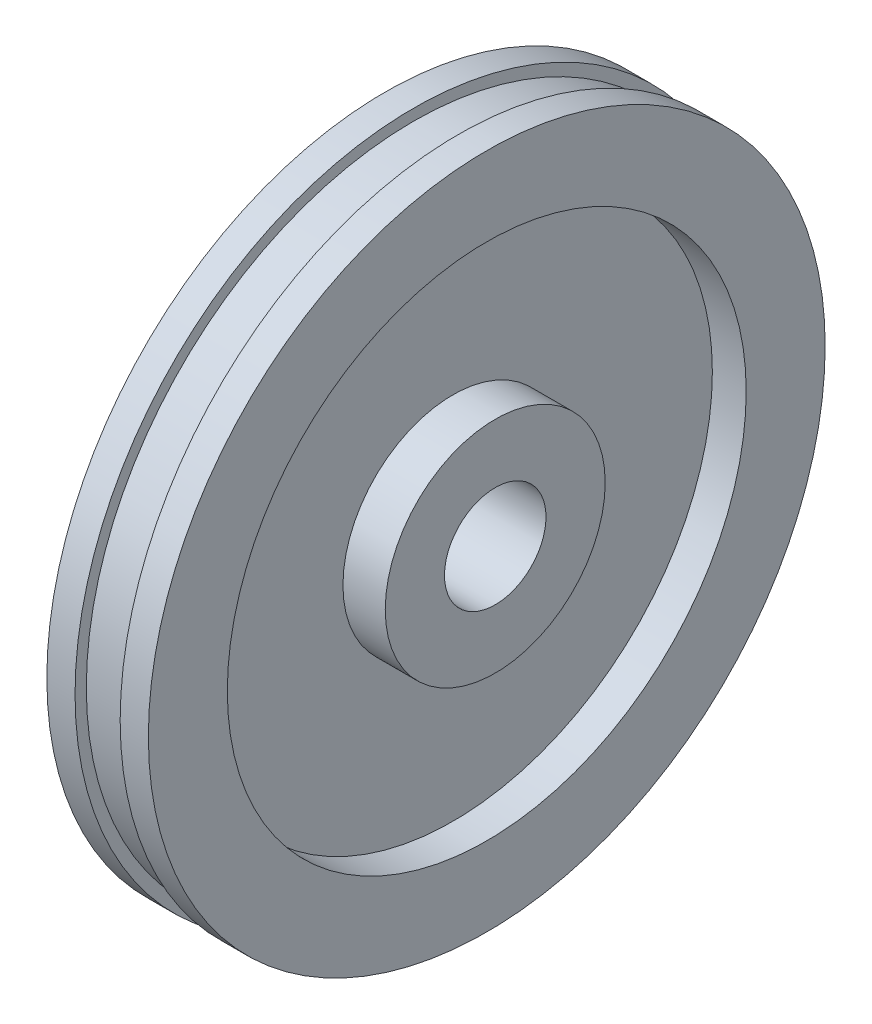
from build123d import *


with BuildPart() as part:
    # Esquisse1 → Révolution1 (revolve)
    with BuildSketch(Plane.XY, mode=Mode.PRIVATE) as r_volution1_sk:
        Polygon((0, 0), (21, 0), (21, 10.5), (13.5, 10.5), (13.5, 37), (19.5, 37), (19.5, 51), (14.5, 51), (14.5, 49), (6.5, 49), (6.5, 51), (1.5, 51), (1.5, 37), (7.5, 37), (7.5, 10.5), (0, 10.5), align=None)
    revolve(r_volution1_sk.sketch.rotate(Axis((0, -9, 0), (1, 0, 0)), 90), axis=Axis((0, -9, 0), (1, 0, 0)))


solid = part.part
